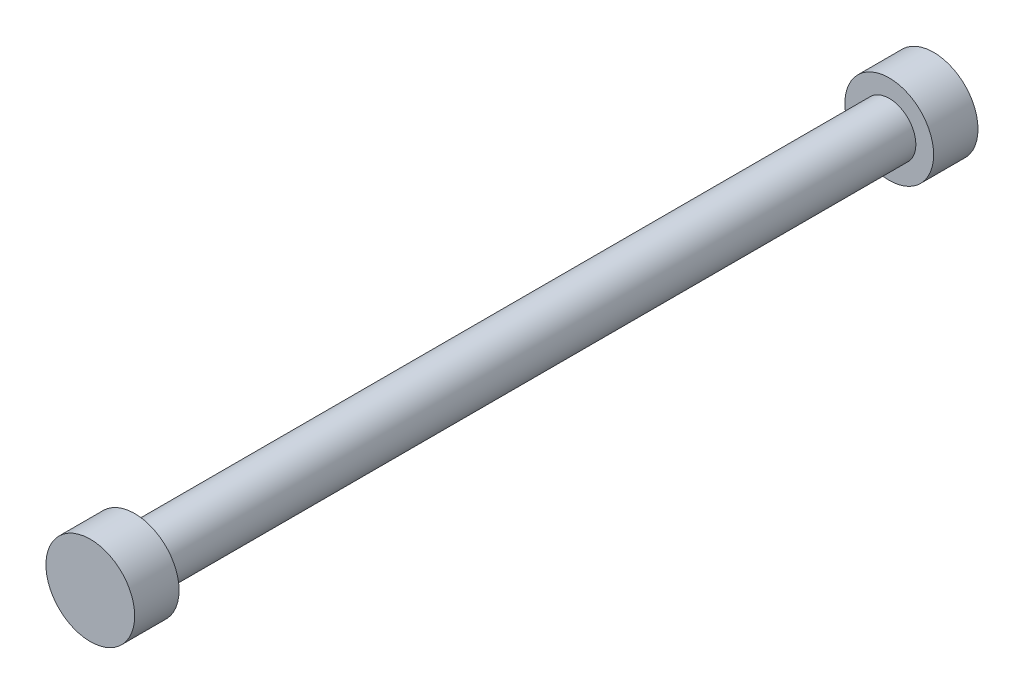
from build123d import *

# Parameters (mm, degrees)
SKETCH1_R           = 3
BOSS_EXTRUDE1_DEPTH = 42.5
SKETCH2_R           = 5
BOSS_EXTRUDE2_DEPTH = 5


with BuildPart() as part:
    # Sketch1 → Boss-Extrude1 (new, symmetric)
    with BuildSketch(Plane.XY):
        Circle(SKETCH1_R)
    extrude(amount=BOSS_EXTRUDE1_DEPTH, both=True)

    # Sketch2 → Boss-Extrude2 (add)
    with BuildSketch(Plane.XY.offset(42.5)):
        Circle(SKETCH2_R)
    boss_extrude2 = extrude(amount=BOSS_EXTRUDE2_DEPTH)

    # Mirror1: Boss-Extrude2 across plane
    add(boss_extrude2.mirror(Plane.XY))


solid = part.part
